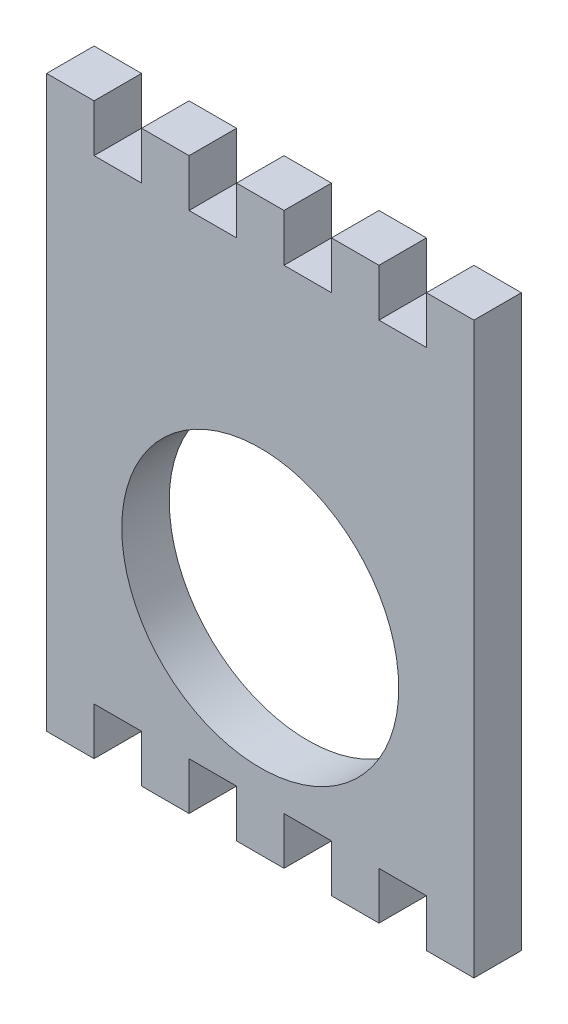
from build123d import *

# Parameters (mm, degrees)
SKETCH1_R           = 8.75
BOSS_EXTRUDE1_DEPTH = 3


with BuildPart() as part:
    # Sketch1 → Boss-Extrude1 (new body)
    with BuildSketch(Plane.XY):
        Polygon((-33.829731544, 43.380302013), (-30.829731544, 43.380302013), (-30.829731544, 40.380302013), (-27.829731544, 40.380302013), (-27.829731544, 43.380302013), (-24.829731544, 43.380302013), (-24.829731544, 40.380302013), (-21.829731544, 40.380302013), (-21.829731544, 43.380302013), (-18.829731544, 43.380302013), (-18.829731544, 40.380302013), (-15.829731544, 40.380302013), (-15.829731544, 43.380302013), (-12.829731544, 43.380302013), (-12.829731544, 40.380302013), (-9.829731544, 40.380302013), (-9.829731544, 43.380302013), (-6.829731544, 43.380302013), (-6.829731544, 7.380302013), (-9.829731544, 7.380302013), (-9.829731544, 10.380302013), (-12.829731544, 10.380302013), (-12.829731544, 7.380302013), (-15.829731544, 7.380302013), (-15.829731544, 10.380302013), (-18.829731544, 10.380302013), (-18.829731544, 7.380302013), (-21.829731544, 7.380302013), (-21.829731544, 10.380302013), (-24.829731544, 10.380302013), (-24.829731544, 7.380302013), (-27.829731544, 7.380302013), (-27.829731544, 10.380302013), (-30.829731544, 10.380302013), (-30.829731544, 7.380302013), (-33.829731544, 7.380302013), align=None)
        with Locations((-20.329731544, 20.880302013)):
            Circle(SKETCH1_R, mode=Mode.SUBTRACT)
    extrude(amount=BOSS_EXTRUDE1_DEPTH)


solid = part.part
